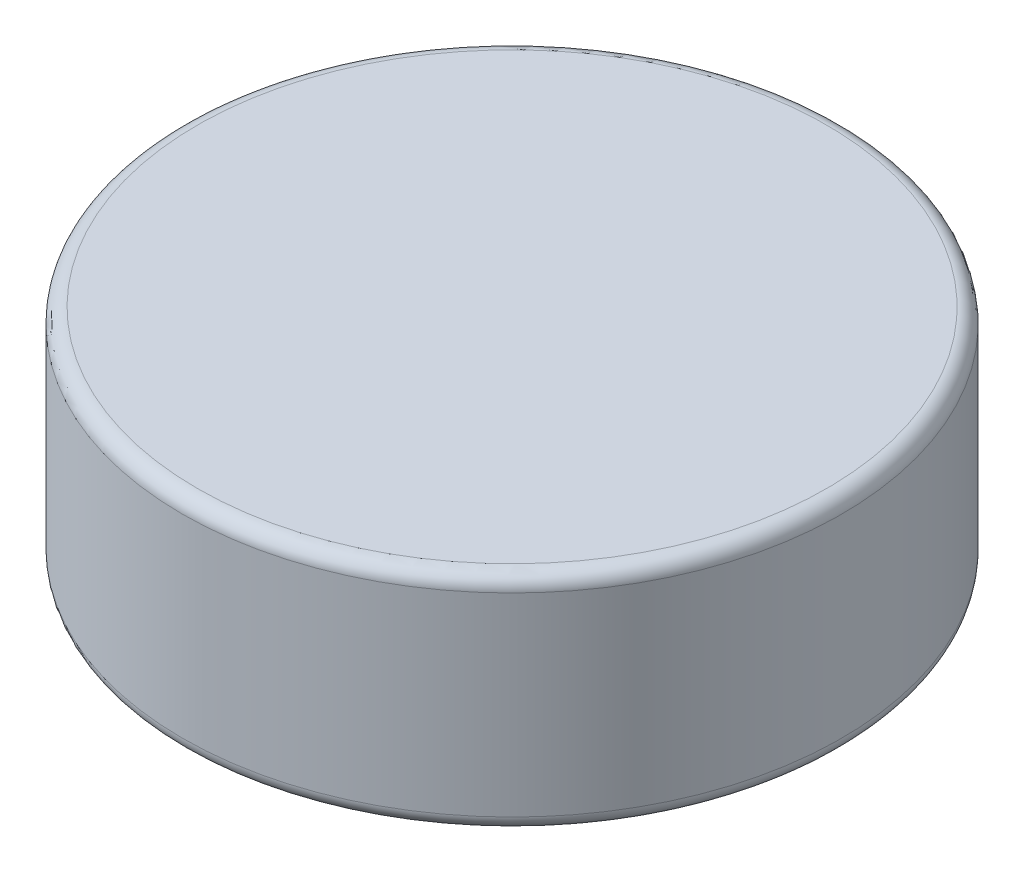
from build123d import *

# Parameters (mm, degrees)
SKETCH2_R           = 22.1869
BOSS_EXTRUDE1_DEPTH = 15.0622
FILLET1_R           = 1


with BuildPart() as part:
    # Sketch2 → Boss-Extrude1 (new body)
    with BuildSketch(Plane(origin=(0, 0, 0), x_dir=(1, 0, 0), z_dir=(0, 1, 0))):
        with Locations(Location((0, 0, 0), (0, 0, 270))):
            Circle(SKETCH2_R)
    extrude(amount=BOSS_EXTRUDE1_DEPTH)

    # Fillet1
    fillet1_edges = [part.edges().sort_by_distance(p)[0] for p in [
        (0, 0, -22.1869),
        (0, 15.0622, -22.1869),
    ]]
    fillet(fillet1_edges, radius=FILLET1_R)


solid = part.part
